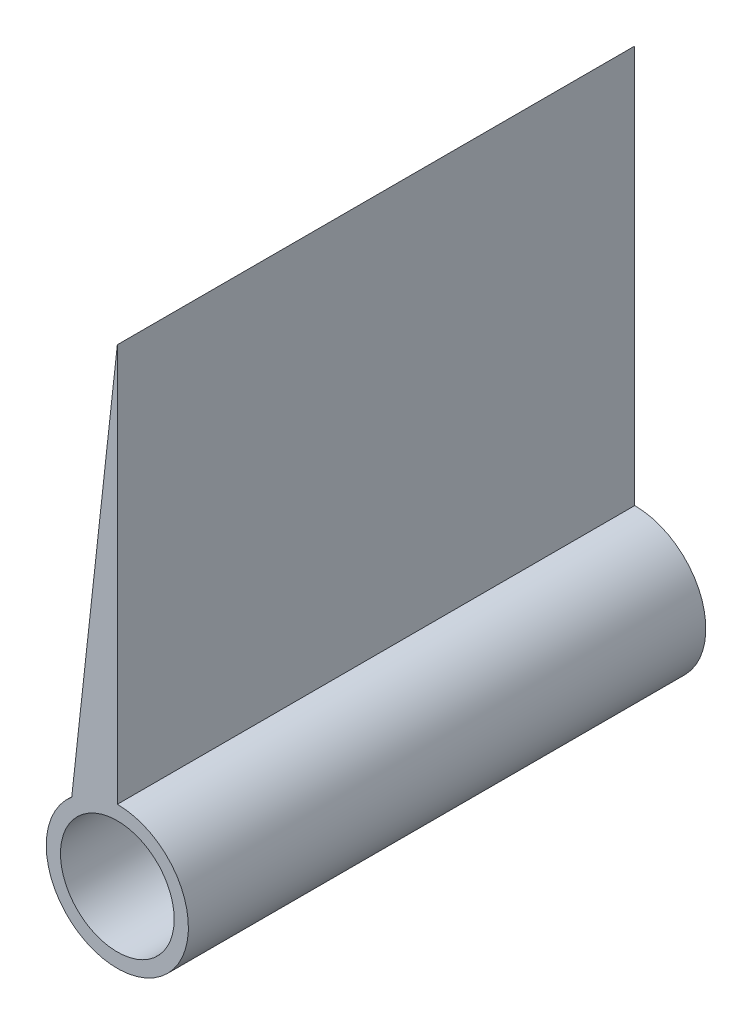
from build123d import *

# Parameters (mm, degrees)
SKETCH1_R           = 6.25
SKETCH1_R_2         = 5
BOSS_EXTRUDE1_DEPTH = 45.5
BOSS_EXTRUDE4_DEPTH = 45.5


with BuildPart() as part:
    # Sketch1 → Boss-Extrude1 (new body)
    with BuildSketch(Plane.XY):
        Circle(SKETCH1_R)
        Circle(SKETCH1_R_2, mode=Mode.SUBTRACT)
    extrude(amount=BOSS_EXTRUDE1_DEPTH)

    # Sketch6 → Boss-Extrude4 (add)
    with BuildSketch(Plane.XY):
        with BuildLine():
            Line((0, 6.25), (0, 41.25))
            Line((0, 41.25), (-4.008188313, 4.795511073))
            ThreePointArc((-4.008188313, 4.795511073), (-2.131965736, 5.875135922), (0, 6.25))
        make_face()
    extrude(amount=BOSS_EXTRUDE4_DEPTH)


solid = part.part
